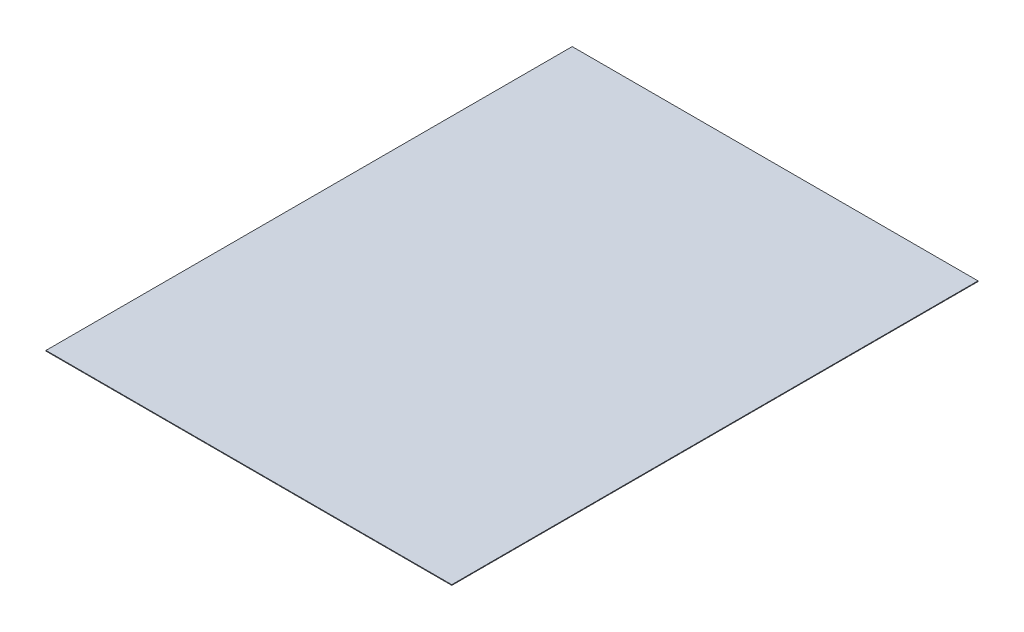
from build123d import *

# Parameters (mm, degrees)
SKETCH1_W                = 615
SKETCH1_H                = 1
TOPPING_IC_TAVAN_1_DEPTH = 797.5


with BuildPart() as part:
    # Sketch1 → TOPPING_ic_tavan_1 (new body)
    with BuildSketch(Plane.XY):
        with Locations((350, 1968)):
            Rectangle(SKETCH1_W, SKETCH1_H)
    extrude(amount=-TOPPING_IC_TAVAN_1_DEPTH)


solid = part.part
